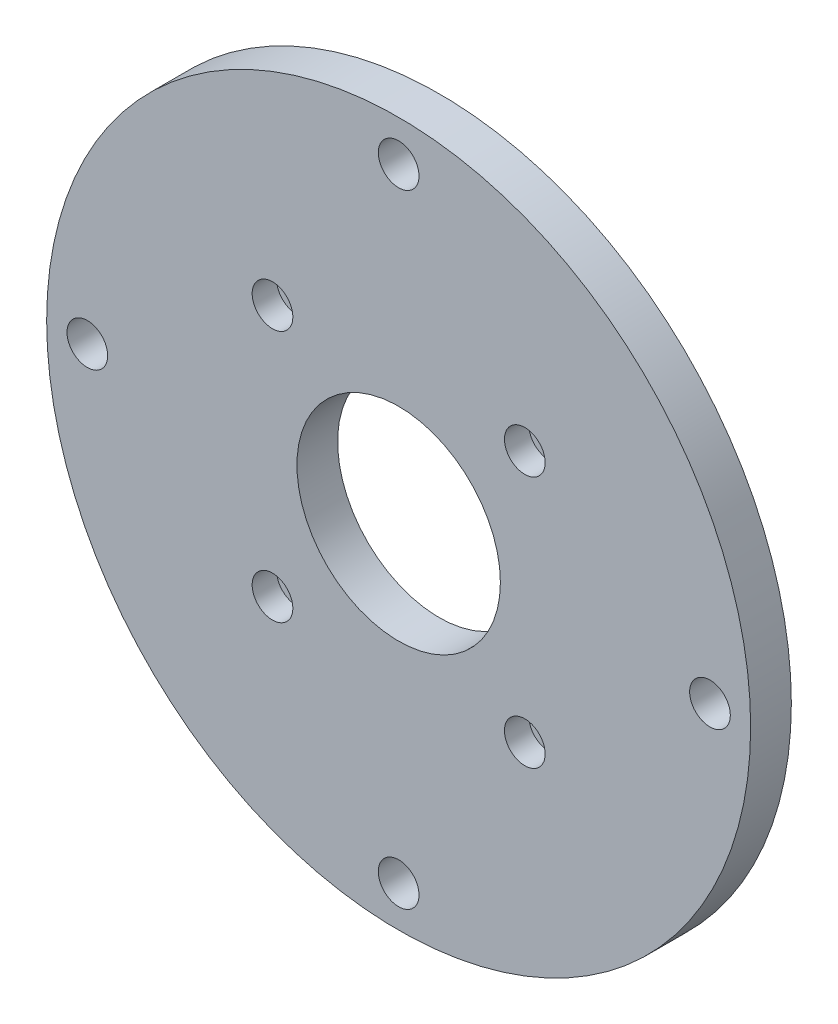
from build123d import *

# Parameters (mm, degrees)
SKETCH1_R           = 43.25
SKETCH1_R_2         = 2.5
SKETCH1_R_3         = 1.75
SKETCH1_R_4         = 12.5
BOSS_EXTRUDE1_DEPTH = 5
SKETCH2_R           = 2.5
CUT_EXTRUDE1_DEPTH  = 3


with BuildPart() as part:
    # Sketch1 → Boss-Extrude1 (new body)
    with BuildSketch(Plane.XY):
        Circle(SKETCH1_R)
        with Locations((0, 38.25)):
            Circle(SKETCH1_R_2, mode=Mode.SUBTRACT)
        with Locations((38.25, 0)):
            Circle(SKETCH1_R_2, mode=Mode.SUBTRACT)
        with Locations((0, -38.25)):
            Circle(SKETCH1_R_2, mode=Mode.SUBTRACT)
        with Locations((-38.25, 0)):
            Circle(SKETCH1_R_2, mode=Mode.SUBTRACT)
        with Locations((-15.5, 15.5)):
            Circle(SKETCH1_R_3, mode=Mode.SUBTRACT)
        with Locations((15.5, 15.5)):
            Circle(SKETCH1_R_3, mode=Mode.SUBTRACT)
        with Locations((15.5, -15.5)):
            Circle(SKETCH1_R_3, mode=Mode.SUBTRACT)
        with Locations((-15.5, -15.5)):
            Circle(SKETCH1_R_3, mode=Mode.SUBTRACT)
        Circle(SKETCH1_R_4, mode=Mode.SUBTRACT)
    extrude(amount=BOSS_EXTRUDE1_DEPTH)

    # Sketch2 → Cut-Extrude1 (cut)
    with BuildSketch(Plane.XY.offset(5)):
        with Locations((-15.5, 15.5)):
            Circle(SKETCH2_R)
        with Locations((15.5, 15.5)):
            Circle(SKETCH2_R)
        with Locations((15.5, -15.5)):
            Circle(SKETCH2_R)
        with Locations((-15.5, -15.5)):
            Circle(SKETCH2_R)
    extrude(amount=-CUT_EXTRUDE1_DEPTH, mode=Mode.SUBTRACT)


solid = part.part
